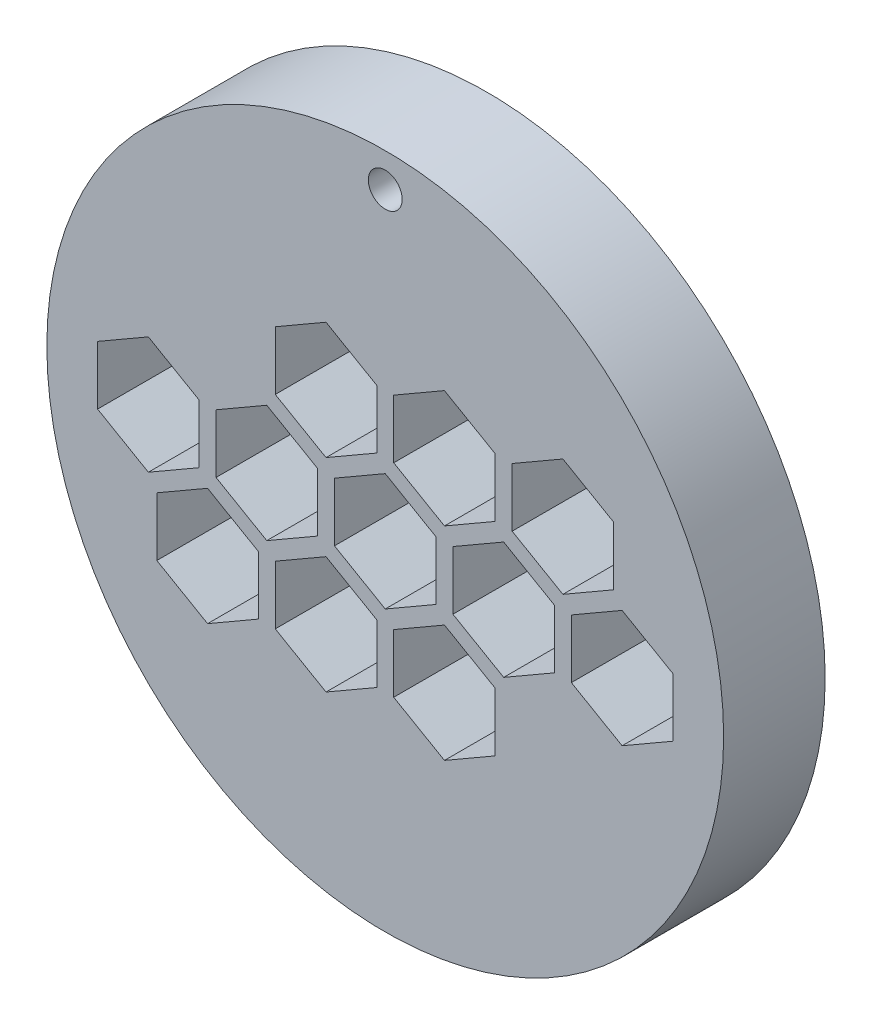
from build123d import *

# Parameters (mm, degrees)
SKETCH1_R           = 10
SKETCH1_R_2         = 0.5
BOSS_EXTRUDE1_DEPTH = 3


with BuildPart() as part:
    # Sketch1 → Boss-Extrude1 (new body)
    with BuildSketch(Plane.XY):
        Circle(SKETCH1_R)
        with Locations((0, 9)):
            Circle(SKETCH1_R_2, mode=Mode.SUBTRACT)
        Polygon((2, -0.866025404), (3.5, -1.732050808), (5, -0.866025404), (5, 0.866025404), (3.5, 1.732050808), (2, 0.866025404), align=None, mode=Mode.SUBTRACT)
        Polygon((-1.75, 1.267949192), (-0.25, 2.133974596), (-0.25, 3.866025404), (-1.75, 4.732050808), (-3.25, 3.866025404), (-3.25, 2.133974596), align=None, mode=Mode.SUBTRACT)
        Polygon((-1.5, -0.866025404), (0, -1.732050808), (1.5, -0.866025404), (1.5, 0.866025404), (0, 1.732050808), (-1.5, 0.866025404), align=None, mode=Mode.SUBTRACT)
        Polygon((5.5, -0.866025404), (7, -1.732050808), (8.5, -0.866025404), (8.5, 0.866025404), (7, 1.732050808), (5.5, 0.866025404), align=None, mode=Mode.SUBTRACT)
        Polygon((-5.5, 0.866025404), (-5.5, -0.866025404), (-7, -1.732050808), (-8.5, -0.866025404), (-8.5, 0.866025404), (-7, 1.732050808), align=None, mode=Mode.SUBTRACT)
        Polygon((-2, 0.866025404), (-2, -0.866025404), (-3.5, -1.732050808), (-5, -0.866025404), (-5, 0.866025404), (-3.5, 1.732050808), align=None, mode=Mode.SUBTRACT)
        Polygon((1.75, 1.267949192), (3.25, 2.133974596), (3.25, 3.866025404), (1.75, 4.732050808), (0.25, 3.866025404), (0.25, 2.133974596), align=None, mode=Mode.SUBTRACT)
        Polygon((5.25, 1.267949192), (6.75, 2.133974596), (6.75, 3.866025404), (5.25, 4.732050808), (3.75, 3.866025404), (3.75, 2.133974596), align=None, mode=Mode.SUBTRACT)
        Polygon((-0.25, -2.133974596), (-1.75, -1.267949192), (-3.25, -2.133974596), (-3.25, -3.866025404), (-1.75, -4.732050808), (-0.25, -3.866025404), align=None, mode=Mode.SUBTRACT)
        Polygon((3.25, -2.133974596), (1.75, -1.267949192), (0.25, -2.133974596), (0.25, -3.866025404), (1.75, -4.732050808), (3.25, -3.866025404), align=None, mode=Mode.SUBTRACT)
        Polygon((-3.75, -2.133974596), (-5.25, -1.267949192), (-6.75, -2.133974596), (-6.75, -3.866025404), (-5.25, -4.732050808), (-3.75, -3.866025404), align=None, mode=Mode.SUBTRACT)
    extrude(amount=BOSS_EXTRUDE1_DEPTH)


solid = part.part
